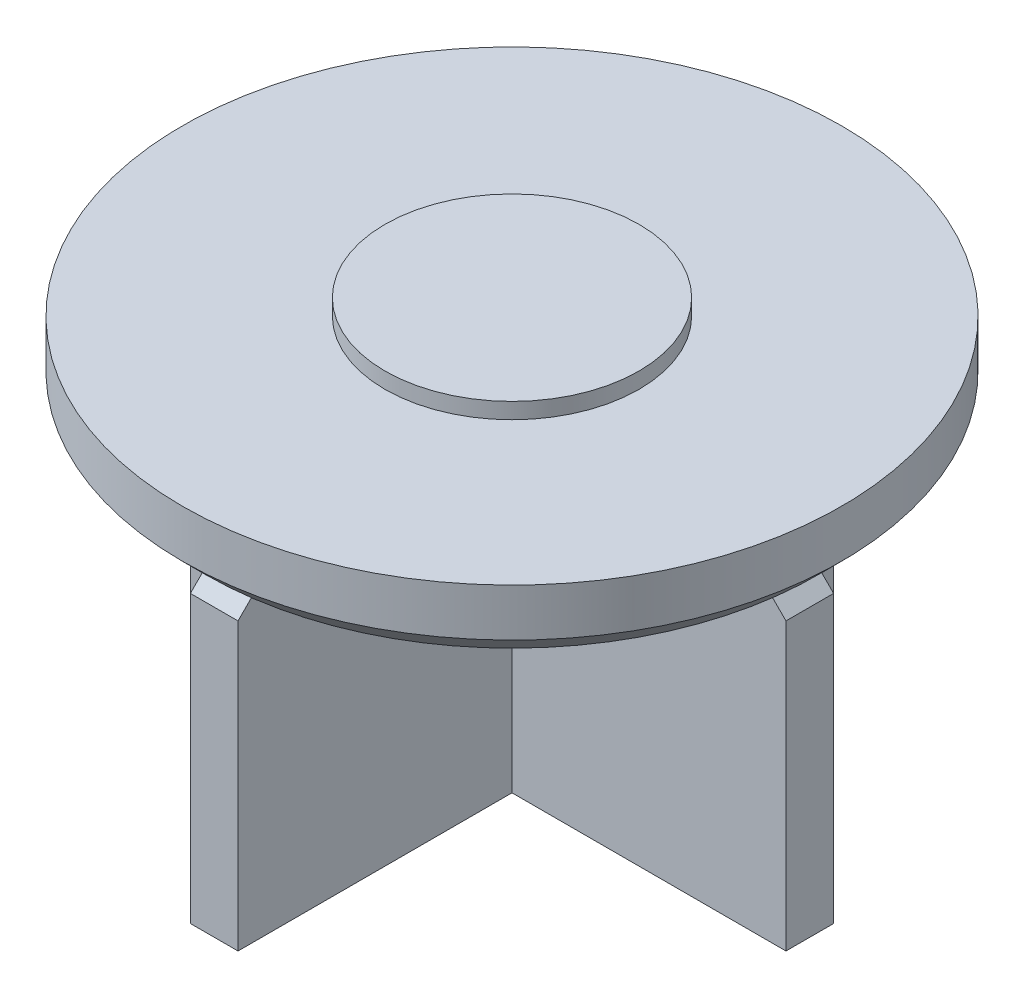
from build123d import *

# Parameters (mm, degrees)
BOSS_EXTRUDE1_DEPTH = 40
CHAMFER1_SIZE       = 4
SKETCH3_R           = 41.5
BOSS_EXTRUDE2_DEPTH = 9
SKETCH4_R           = 16
BOSS_EXTRUDE3_DEPTH = 2
CHAMFER2_SIZE       = 3


with BuildPart() as part:
    # Sketch1 → Boss-Extrude1 (new body)
    with BuildSketch(Plane(origin=(0, 0, 0), x_dir=(1, 0, 0), z_dir=(0, 1, 0))):
        Polygon((3, 3), (37.5, 3), (37.5, -3), (3, -3), (3, -37.5), (-3, -37.5), (-3, -3), (-37.5, -3), (-37.5, 3), (-3, 3), (-3, 37.5), (3, 37.5), align=None)
    extrude(amount=BOSS_EXTRUDE1_DEPTH)

    # Chamfer1
    chamfer1_edges = [part.edges().sort_by_distance(p)[0] for p in [
        (0, 40, -37.5),
        (-37.5, 40, 0),
        (0, 40, 37.5),
        (37.5, 40, 0),
    ]]
    chamfer(chamfer1_edges, length=CHAMFER1_SIZE)

    # Sketch3 → Boss-Extrude2 (add)
    with BuildSketch(Plane(origin=(0, 40, 0), x_dir=(1, 0, 0), z_dir=(0, 1, 0))):
        with Locations(Location((0, 0, 0), (0, 0, 270))):
            Circle(SKETCH3_R)
    extrude(amount=BOSS_EXTRUDE2_DEPTH)

    # Sketch4 → Boss-Extrude3 (add)
    with BuildSketch(Plane(origin=(0, 49, 0), x_dir=(1, 0, 0), z_dir=(0, 1, 0))):
        with Locations(Location((0, 0, 0), (0, 0, 270))):
            Circle(SKETCH4_R)
    extrude(amount=BOSS_EXTRUDE3_DEPTH)

    # Chamfer2
    chamfer2_edges = [part.edges().sort_by_distance(p)[0] for p in [
        (0, 40, -41.5),
    ]]
    chamfer(chamfer2_edges, length=CHAMFER2_SIZE)


solid = part.part
